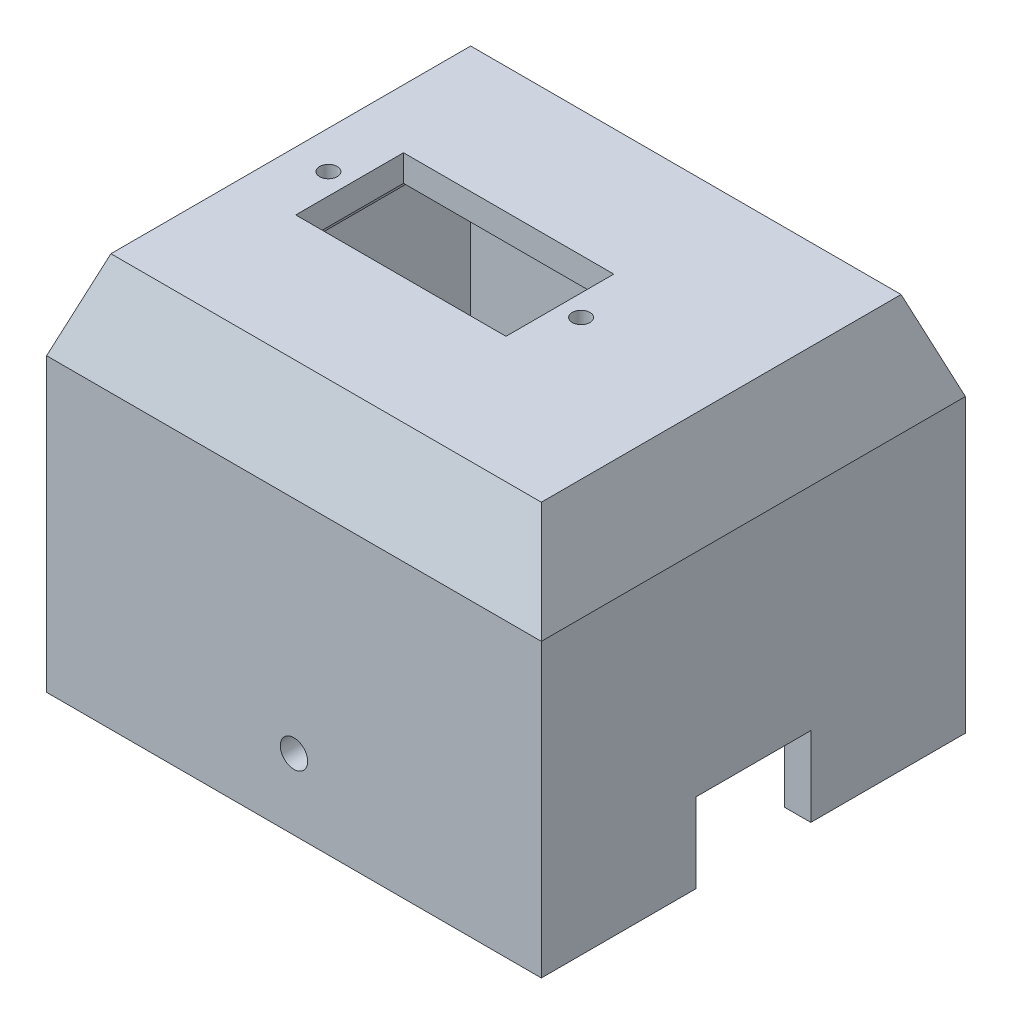
from build123d import *
from OCP.BRepFilletAPI import BRepFilletAPI_MakeChamfer

# Parameters (mm, degrees)
SKETCH_47_W         = 56
SKETCH_47_H         = 48
EXTRUDE_4_DEPTH     = 43
CHAMFER_1_SIZE      = 10
CHAMFER_1_SIZE2     = 3.639702343
SHELL_1_T           = -3
CUT_EXTRUDE_3_REACH = 86.392
SKETCH_48_R         = 1
SKETCH_48_W         = 23.8
SKETCH_48_H         = 12.2
SKETCH_49_R         = 1.55
CUT_EXTRUDE_4_DEPTH = 71.263788682
CUT_EXTRUDE_5_REACH = 76.572
SKETCH_50_W         = 13
SKETCH_50_H         = 9
CUT_EXTRUDE_6_REACH = 76.572
SKETCH_51_W         = 10.719183514
SKETCH_51_H         = 21.879791556


with BuildPart() as part:
    # 草图47 → 凸台-拉伸4 (new body)
    with BuildSketch(Plane(origin=(0, 0, 0), x_dir=(1, 0, 0), z_dir=(0, 1, 0))):
        Rectangle(SKETCH_47_W, SKETCH_47_H)
    extrude(amount=EXTRUDE_4_DEPTH)

    # 倒角1: one chamfer whose edges measure the first distance from different faces: ONE call of the kernel's chamfer builder (chamfer() names one face for all edges)
    chamfer_1_edges_1 = [part.edges().sort_by_distance(p)[0] for p in [
        (28, 43, 0),
    ]]
    chamfer_1_side_1 = [part.faces().sort_by_distance(p)[0] for p in [
        (28, 21.5, 0),
    ]]
    chamfer_1_edges_2 = [part.edges().sort_by_distance(p)[0] for p in [
        (0, 43, -24),
    ]]
    chamfer_1_side_2 = [part.faces().sort_by_distance(p)[0] for p in [
        (0, 21.5, -24),
    ]]
    chamfer_1_edges_3 = [part.edges().sort_by_distance(p)[0] for p in [
        (-28, 43, 0),
    ]]
    chamfer_1_side_3 = [part.faces().sort_by_distance(p)[0] for p in [
        (-28, 21.5, 0),
    ]]
    chamfer_1_edges_4 = [part.edges().sort_by_distance(p)[0] for p in [
        (0, 43, 24),
    ]]
    chamfer_1_side_4 = [part.faces().sort_by_distance(p)[0] for p in [
        (0, 21.5, 24),
    ]]
    chamfer_1 = BRepFilletAPI_MakeChamfer(part.part.solid().wrapped)
    for e in chamfer_1_edges_1:
        chamfer_1.Add(CHAMFER_1_SIZE, CHAMFER_1_SIZE2, e.wrapped, chamfer_1_side_1[0].wrapped)  # the first distance lies on this face
    for e in chamfer_1_edges_2:
        chamfer_1.Add(CHAMFER_1_SIZE, CHAMFER_1_SIZE2, e.wrapped, chamfer_1_side_2[0].wrapped)  # the first distance lies on this face
    for e in chamfer_1_edges_3:
        chamfer_1.Add(CHAMFER_1_SIZE, CHAMFER_1_SIZE2, e.wrapped, chamfer_1_side_3[0].wrapped)  # the first distance lies on this face
    for e in chamfer_1_edges_4:
        chamfer_1.Add(CHAMFER_1_SIZE, CHAMFER_1_SIZE2, e.wrapped, chamfer_1_side_4[0].wrapped)  # the first distance lies on this face
    add(Compound.cast(chamfer_1.Shape()), mode=Mode.REPLACE)

    # 抽壳1
    shell_1_openings = [part.faces().sort_by_distance(p)[0] for p in [
        (0, 0, 0),
    ]]
    offset(amount=SHELL_1_T, openings=shell_1_openings, kind=Kind.INTERSECTION)

    # 草图48 → 切除-拉伸3 (cut, up to next)
    with BuildSketch(Plane(origin=(0, 43, -43), x_dir=(1, 0, 0), z_dir=(0, -1, 0)), mode=Mode.PRIVATE) as cut_extrude_3_sk1:
        with Locations(Location((-20.1, 43, 0), (0, 0, 90))):
            Circle(SKETCH_48_R)
    cut_extrude_3_tool1 = extrude(cut_extrude_3_sk1.sketch, amount=CUT_EXTRUDE_3_REACH, mode=Mode.PRIVATE) & part.part
    # 草图48 → 切除-拉伸3 (cut, up to next)
    with BuildSketch(Plane(origin=(0, 43, -43), x_dir=(1, 0, 0), z_dir=(0, -1, 0)), mode=Mode.PRIVATE) as cut_extrude_3_sk2:
        with Locations(Location((8.5, 43, 0), (0, 0, 90))):
            Circle(SKETCH_48_R)
    cut_extrude_3_tool2 = extrude(cut_extrude_3_sk2.sketch, amount=CUT_EXTRUDE_3_REACH, mode=Mode.PRIVATE) & part.part
    # 草图48 → 切除-拉伸3 (cut, up to next)
    with BuildSketch(Plane(origin=(0, 43, -43), x_dir=(1, 0, 0), z_dir=(0, -1, 0)), mode=Mode.PRIVATE) as cut_extrude_3_sk3:
        with Locations((-5.8, 43)):
            Rectangle(SKETCH_48_W, SKETCH_48_H)
    cut_extrude_3_tool3 = extrude(cut_extrude_3_sk3.sketch, amount=CUT_EXTRUDE_3_REACH, mode=Mode.PRIVATE) & part.part
    add(cut_extrude_3_tool1.solids().sort_by_distance((-20.1, 43, 0))[0], mode=Mode.SUBTRACT)
    add(cut_extrude_3_tool2.solids().sort_by_distance((8.5, 43, 0))[0], mode=Mode.SUBTRACT)
    add(cut_extrude_3_tool3.solids().sort_by_distance((-5.8, 43, 0))[0], mode=Mode.SUBTRACT)

    # 草图49 → 切除-拉伸4 (cut, through all)
    with BuildSketch(Plane(origin=(0, 0, -24), x_dir=(-1, 0, 0), z_dir=(0, 0, -1))):
        with Locations((0, 8)):
            Circle(SKETCH_49_R)
    extrude(amount=-CUT_EXTRUDE_4_DEPTH, mode=Mode.SUBTRACT)

    # 草图50 → 切除-拉伸5 (cut, up to next)
    with BuildSketch(Plane(origin=(28, 0, 0), x_dir=(0, 0, -1), z_dir=(1, 0, 0)), mode=Mode.PRIVATE) as cut_extrude_5_sk1:
        with Locations((0, 4.5)):
            Rectangle(SKETCH_50_W, SKETCH_50_H)
    cut_extrude_5_tool1 = extrude(cut_extrude_5_sk1.sketch, amount=-CUT_EXTRUDE_5_REACH, mode=Mode.PRIVATE) & part.part
    add(cut_extrude_5_tool1.solids().sort_by_distance((28, 4.5, 0))[0], mode=Mode.SUBTRACT)

    # 草图51 → 切除-拉伸6 (cut, up to next)
    with BuildSketch(Plane.ZY.offset(28), mode=Mode.PRIVATE) as cut_extrude_6_sk1:
        with Locations((0, 10.939895778)):
            Rectangle(SKETCH_51_W, SKETCH_51_H)
    cut_extrude_6_tool1 = extrude(cut_extrude_6_sk1.sketch, amount=-CUT_EXTRUDE_6_REACH, mode=Mode.PRIVATE) & part.part
    add(cut_extrude_6_tool1.solids().sort_by_distance((-28, 10.939896, 0))[0], mode=Mode.SUBTRACT)


solid = part.part
